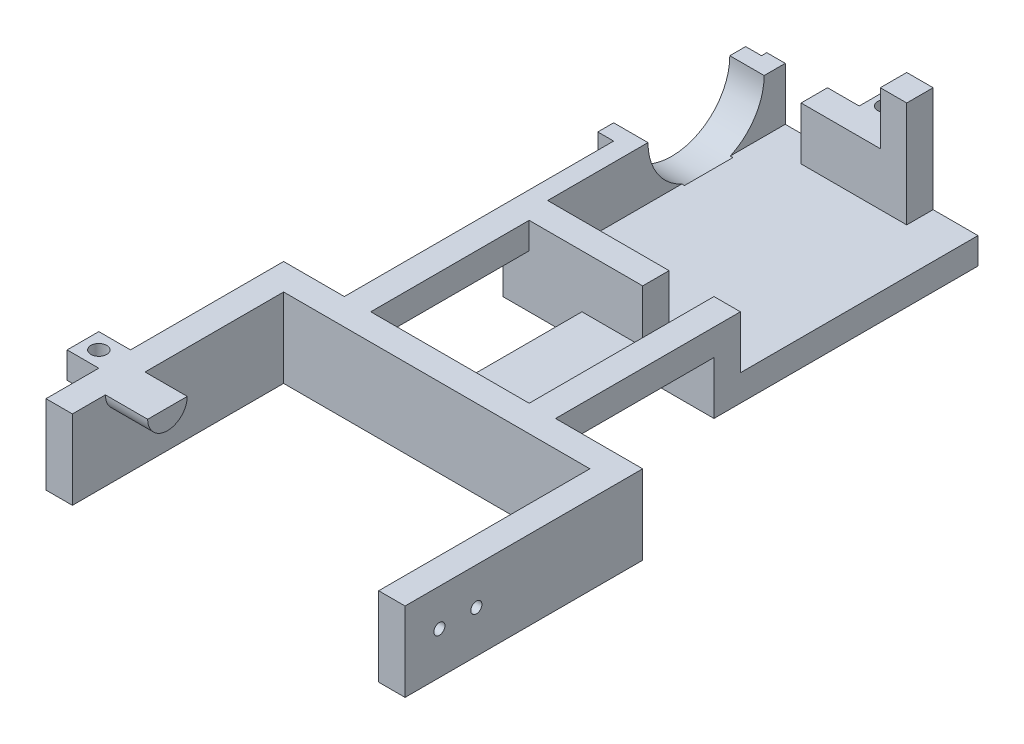
from build123d import *

# Parameters (mm, degrees)
SKETCH1_W            = 40
SKETCH1_H            = 50
BOSS_EXTRUDE1_DEPTH  = 5
SKETCH3_W            = 5
SKETCH3_H            = 5
BOSS_EXTRUDE5_DEPTH  = 20
SKETCH3_3_W          = 15
SKETCH3_3_H          = 5
SKETCH3_3_W_2        = 5
BOSS_EXTRUDE6_DEPTH  = 10
CUT_EXTRUDE3_DEPTH   = 4
SKETCH11_W           = 5
SKETCH11_H           = 5
BOSS_EXTRUDE10_DEPTH = 5
SKETCH12_R           = 1.5
CUT_EXTRUDE4_DEPTH   = 5
SKETCH14_W           = 10
SKETCH14_H           = 5
SKETCH14_W_2         = 5
BOSS_EXTRUDE12_DEPTH = 30
SKETCH15_W           = 40
SKETCH15_H           = 15
BOSS_EXTRUDE13_DEPTH = 5
BOSS_EXTRUDE15_DEPTH = 16.5
BOSS_EXTRUDE17_DEPTH = 11.5
SKETCH18_W           = 5
SKETCH18_H           = 15
BOSS_EXTRUDE18_DEPTH = 40
BOSS_EXTRUDE19_DEPTH = 8
SKETCH20_W           = 6
SKETCH20_H           = 5
BOSS_EXTRUDE20_DEPTH = 6
SKETCH21_R           = 1.5
CUT_EXTRUDE5_DEPTH   = 5
SKETCH24_R           = 1.05
CUT_EXTRUDE7_DEPTH   = 5
BOSS_EXTRUDE21_START = 3
BOSS_EXTRUDE21_DEPTH = 3


with BuildPart() as part:
    # Sketch1 → Boss-Extrude1 (new body)
    with BuildSketch(Plane(origin=(0, 0, 0), x_dir=(1, 0, 0), z_dir=(0, 1, 0))):
        Rectangle(SKETCH1_W, SKETCH1_H)
    extrude(amount=BOSS_EXTRUDE1_DEPTH)

    # Sketch3 → Boss-Extrude5 (add)
    with BuildSketch(Plane(origin=(0, 5, 0), x_dir=(1, 0, 0), z_dir=(0, 1, 0))):
        with Locations((9, 22.5)):
            Rectangle(SKETCH3_W, SKETCH3_H)
    extrude(amount=BOSS_EXTRUDE5_DEPTH)

    # Sketch3<3> → Boss-Extrude6 (add)
    with BuildSketch(Plane(origin=(0, 5, 0), x_dir=(1, 0, 0), z_dir=(0, 1, 0))):
        with Locations((-1, 22.5)):
            Rectangle(SKETCH3_3_W, SKETCH3_3_H)
        with Locations((17.5, -22.5)):
            Rectangle(SKETCH3_3_W_2, SKETCH3_3_H)
        Polygon((-16.5, -20), (-16.5, 25), (-20, 25), (-20, -25), (6.5, -25), (6.5, -20), align=None)
    extrude(amount=BOSS_EXTRUDE6_DEPTH)

    # Sketch8 → Cut-Extrude3 (cut)
    with BuildSketch(Plane.ZY.offset(20)):
        with BuildLine():
            Line((1, 15), (-21, 15))
            ThreePointArc((-21, 15), (-10, 4), (1, 15))
        make_face()
    extrude(amount=-CUT_EXTRUDE3_DEPTH, mode=Mode.SUBTRACT)

    # Sketch11 → Boss-Extrude10 (add)
    with BuildSketch(Plane(origin=(0, 0, -25), x_dir=(-1, 0, 0), z_dir=(0, 0, -1))):
        with Locations((0, 12.5)):
            Rectangle(SKETCH11_W, SKETCH11_H)
    extrude(amount=BOSS_EXTRUDE10_DEPTH)

    # Sketch12 → Cut-Extrude4 (cut)
    with BuildSketch(Plane.XZ.offset(-10)):
        with Locations((0, -27.5)):
            Circle(SKETCH12_R)
    extrude(amount=-CUT_EXTRUDE4_DEPTH, mode=Mode.SUBTRACT)

    # Sketch14 → Boss-Extrude12 (add)
    with BuildSketch(Plane.XY.offset(25)):
        with Locations((0, 2.5)):
            Rectangle(SKETCH14_W, SKETCH14_H)
        with Locations((-17.5, 12.5)):
            Rectangle(SKETCH14_W_2, SKETCH14_H)
        with Locations((17.5, 12.5)):
            Rectangle(SKETCH14_W_2, SKETCH14_H)
    extrude(amount=BOSS_EXTRUDE12_DEPTH)

    # Sketch15 → Boss-Extrude13 (add)
    with BuildSketch(Plane.XY.offset(55)):
        with Locations((0, 7.5)):
            Rectangle(SKETCH15_W, SKETCH15_H)
    extrude(amount=BOSS_EXTRUDE13_DEPTH)

    # Sketch16 → Boss-Extrude15 (add)
    with BuildSketch(Plane(origin=(20, 0, 0), x_dir=(0, 0, -1), z_dir=(1, 0, 0))):
        Polygon((-60, 0), (-55, 0), (-55, 10), (-55, 15), (-60, 15), align=None)
    extrude(amount=BOSS_EXTRUDE15_DEPTH)

    # Sketch17 → Boss-Extrude17 (add)
    with BuildSketch(Plane.ZY.offset(20)):
        Polygon((55, 0), (60, 0), (60, 15), (55, 15), (55, 10), align=None)
    extrude(amount=BOSS_EXTRUDE17_DEPTH)

    # Sketch18 → Boss-Extrude18 (add)
    with BuildSketch(Plane.XY.offset(60)):
        with Locations((34, 7.5)):
            Rectangle(SKETCH18_W, SKETCH18_H)
        with Locations((-29, 7.5)):
            Rectangle(SKETCH18_W, SKETCH18_H)
    extrude(amount=BOSS_EXTRUDE18_DEPTH)

    # Sketch19 → Boss-Extrude19 (add)
    with BuildSketch(Plane(origin=(-26.5, 0, 0), x_dir=(0, 0, -1), z_dir=(1, 0, 0))):
        with BuildLine():
            Line((-86.25, 15), (-93.75, 15))
            ThreePointArc((-93.75, 15), (-90, 11.25), (-86.25, 15))
        make_face()
    extrude(amount=BOSS_EXTRUDE19_DEPTH)

    # Sketch20 → Boss-Extrude20 (add)
    with BuildSketch(Plane.ZY.offset(31.5)):
        with Locations((87, 12.5)):
            Rectangle(SKETCH20_W, SKETCH20_H)
    extrude(amount=BOSS_EXTRUDE20_DEPTH)

    # Sketch21 → Cut-Extrude5 (cut)
    with BuildSketch(Plane.XZ.offset(-10)):
        with Locations((-34.5, 87)):
            Circle(SKETCH21_R)
    extrude(amount=-CUT_EXTRUDE5_DEPTH, mode=Mode.SUBTRACT)

    # Sketch24 → Cut-Extrude7 (cut)
    with BuildSketch(Plane.ZY.offset(-31.5)):
        with Locations((93.5, 8)):
            Circle(SKETCH24_R)
        with Locations((86.5, 8)):
            Circle(SKETCH24_R)
    extrude(amount=-CUT_EXTRUDE7_DEPTH, mode=Mode.SUBTRACT)

    # Sketch25 → Boss-Extrude21 (add)
    with BuildSketch(Plane.ZY.offset(20).offset(BOSS_EXTRUDE21_START)):
        with BuildLine():
            Line((-21, 15), (-24, 15))
            Line((-24, 15), (-24, 0))
            Line((-24, 0), (4, 0))
            Line((4, 0), (4, 15))
            Line((4, 15), (1, 15))
            ThreePointArc((1, 15), (-10, 4), (-21, 15))
        make_face()
    extrude(amount=-BOSS_EXTRUDE21_DEPTH)


solid = part.part
